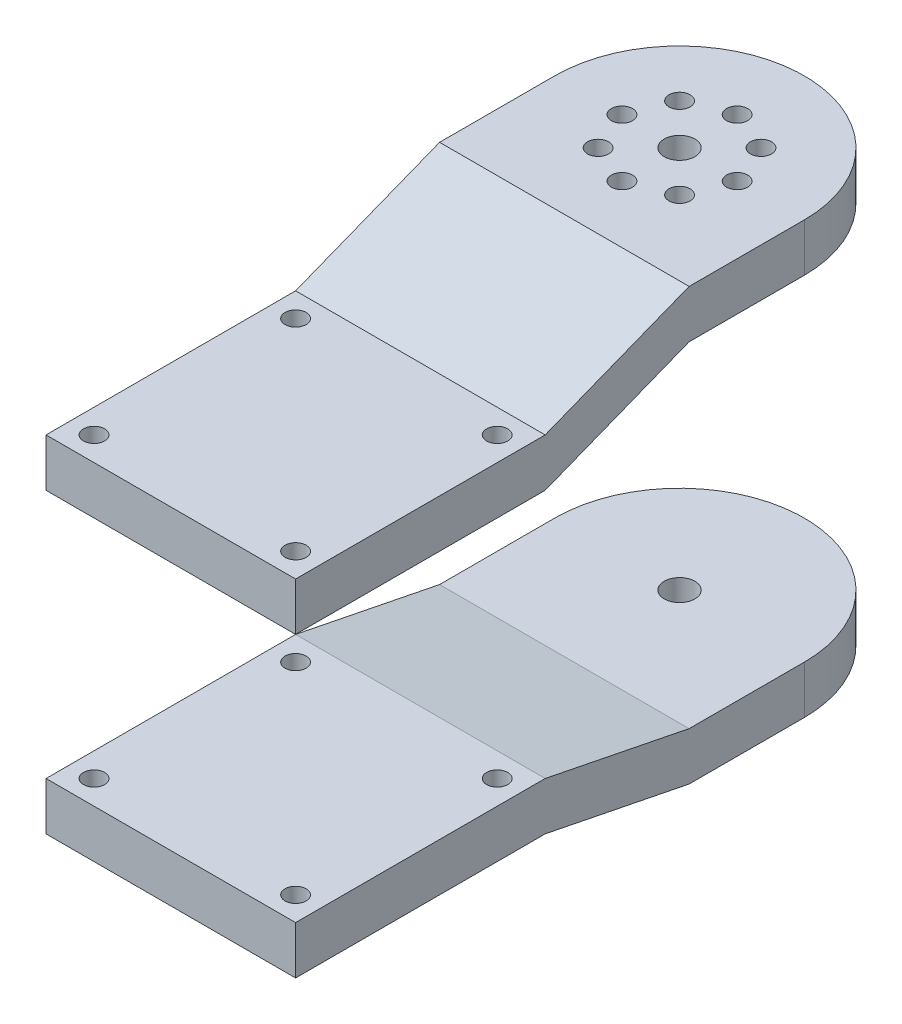
from build123d import *

# Parameters (mm, degrees)
SKETCH_1_R          = 1.1
SKETCH_1_R_2        = 1.6
EXTRUDE_1_DEPTH     = 5
SKETCH_2_R          = 1.6
SKETCH_2_R_2        = 1.1
EXTRUDE_2_DEPTH     = 5
EXTRUDE_START       = -5.9
SKETCH_4_W          = 26
SKETCH_4_H          = 26
SKETCH_4_R          = 1.1
EXTRUDE_3_DEPTH     = 5.9
SKETCH_5_W          = 26
SKETCH_5_H          = 26
SKETCH_5_R          = 1.1
EXTRUDE_4_DEPTH     = 3
EXTRUDE_5_DEPTH     = 26
CUT_EXTRUDE_1_DEPTH = 72.253140282


with BuildPart() as part:
    # ｽｹｯﾁ1 → ﾎﾞｽ - 押し出し1 (new body)
    with BuildSketch(Plane(origin=(0, 0, 0), x_dir=(1, 0, 0), z_dir=(0, 1, 0))):
        with BuildLine():
            Line((-13, 40), (-13, -13))
            Line((-13, -13), (13, -13))
            Line((13, -13), (13, 40))
            ThreePointArc((13, 40), (0, 53), (-13, 40))
        make_face()
        with Locations(Location((-10.5, 10.5, 0), (0, 0, 270))):
            Circle(SKETCH_1_R, mode=Mode.SUBTRACT)
        with Locations(Location((-10.5, -10.5, 0), (0, 0, 270))):
            Circle(SKETCH_1_R, mode=Mode.SUBTRACT)
        with Locations(Location((10.5, -10.5, 0), (0, 0, 270))):
            Circle(SKETCH_1_R, mode=Mode.SUBTRACT)
        with Locations(Location((10.5, 10.5, 0), (0, 0, 270))):
            Circle(SKETCH_1_R, mode=Mode.SUBTRACT)
        with Locations(Location((0, 46, 0), (0, 0, 270))):
            Circle(SKETCH_1_R, mode=Mode.SUBTRACT)
        with Locations(Location((4.242640687, 44.242640687, 0), (0, 0, 270))):
            Circle(SKETCH_1_R, mode=Mode.SUBTRACT)
        with Locations(Location((6, 40, 0), (0, 0, 270))):
            Circle(SKETCH_1_R, mode=Mode.SUBTRACT)
        with Locations(Location((4.242640687, 35.757359313, 0), (0, 0, 270))):
            Circle(SKETCH_1_R, mode=Mode.SUBTRACT)
        with Locations(Location((0, 34, 0), (0, 0, 270))):
            Circle(SKETCH_1_R, mode=Mode.SUBTRACT)
        with Locations(Location((-4.242640687, 35.757359313, 0), (0, 0, 270))):
            Circle(SKETCH_1_R, mode=Mode.SUBTRACT)
        with Locations(Location((-6, 40, 0), (0, 0, 270))):
            Circle(SKETCH_1_R, mode=Mode.SUBTRACT)
        with Locations(Location((-4.242640687, 44.242640687, 0), (0, 0, 270))):
            Circle(SKETCH_1_R, mode=Mode.SUBTRACT)
        with Locations(Location((0, 40, 0), (0, 0, 270))):
            Circle(SKETCH_1_R_2, mode=Mode.SUBTRACT)
    extrude(amount=EXTRUDE_1_DEPTH)

    # ｽｹｯﾁ4 → ﾎﾞｽ - 押し出し3 (add)
    with BuildSketch(Plane(origin=(0, 0, 0), x_dir=(1, 0, 0), z_dir=(0, 1, 0)).offset(EXTRUDE_START)):
        Rectangle(SKETCH_4_W, SKETCH_4_H)
        with Locations(Location((10.5, -10.5, 0), (0, 0, 270))):
            Circle(SKETCH_4_R, mode=Mode.SUBTRACT)
        with Locations(Location((-10.5, -10.5, 0), (0, 0, 270))):
            Circle(SKETCH_4_R, mode=Mode.SUBTRACT)
        with Locations(Location((-10.5, 10.5, 0), (0, 0, 270))):
            Circle(SKETCH_4_R, mode=Mode.SUBTRACT)
        with Locations(Location((10.5, 10.5, 0), (0, 0, 270))):
            Circle(SKETCH_4_R, mode=Mode.SUBTRACT)
    extrude(amount=EXTRUDE_3_DEPTH)



with BuildPart() as body_2:
    # ｽｹｯﾁ2 → ﾎﾞｽ - 押し出し2 (new body)
    with BuildSketch(Plane(origin=(0, -34.9, 0), x_dir=(1, 0, 0), z_dir=(0, 1, 0))):
        with BuildLine():
            Line((13, -13), (13, 40))
            ThreePointArc((13, 40), (0, 53), (-13, 40))
            Line((-13, 40), (-13, -13))
            Line((-13, -13), (13, -13))
        make_face()
        with Locations(Location((0, 40, 0), (0, 0, 270))):
            Circle(SKETCH_2_R, mode=Mode.SUBTRACT)
        with Locations(Location((10.5, -10.5, 0), (0, 0, 270))):
            Circle(SKETCH_2_R_2, mode=Mode.SUBTRACT)
        with Locations(Location((-10.5, -10.5, 0), (0, 0, 270))):
            Circle(SKETCH_2_R_2, mode=Mode.SUBTRACT)
        with Locations(Location((-10.5, 10.5, 0), (0, 0, 270))):
            Circle(SKETCH_2_R_2, mode=Mode.SUBTRACT)
        with Locations(Location((10.5, 10.5, 0), (0, 0, 270))):
            Circle(SKETCH_2_R_2, mode=Mode.SUBTRACT)
    extrude(amount=-EXTRUDE_2_DEPTH)

    # ｽｹｯﾁ5 → ﾎﾞｽ - 押し出し4 (add)
    with BuildSketch(Plane(origin=(0, -34.9, 0), x_dir=(1, 0, 0), z_dir=(0, 1, 0))):
        Rectangle(SKETCH_5_W, SKETCH_5_H)
        with Locations(Location((10.5, -10.5, 0), (0, 0, 270))):
            Circle(SKETCH_5_R, mode=Mode.SUBTRACT)
        with Locations(Location((-10.5, -10.5, 0), (0, 0, 270))):
            Circle(SKETCH_5_R, mode=Mode.SUBTRACT)
        with Locations(Location((-10.5, 10.5, 0), (0, 0, 270))):
            Circle(SKETCH_5_R, mode=Mode.SUBTRACT)
        with Locations(Location((10.5, 10.5, 0), (0, 0, 270))):
            Circle(SKETCH_5_R, mode=Mode.SUBTRACT)
    extrude(amount=EXTRUDE_4_DEPTH)


with BuildPart() as part_1:
    add(part.part)

    add(body_2.part)  # ﾎﾞｽ - 押し出し5 merges body 2
    # ｽｹｯﾁ6 → ﾎﾞｽ - 押し出し5 (add)
    with BuildSketch(Plane(origin=(13, 0, 0), x_dir=(0, 0, -1), z_dir=(1, 0, 0))):
        Polygon((28, 0), (13, -5.9), (13, 0), align=None)
        Polygon((13, -31.9), (13, -34.9), (28, -34.9), align=None)
    extrude(amount=-EXTRUDE_5_DEPTH)

    # ｽｹｯﾁ7 → ｶｯﾄ - 押し出し1 (cut, through all)
    with BuildSketch(Plane(origin=(13, 0, 0), x_dir=(0, 0, -1), z_dir=(1, 0, 0))):
        Polygon((28, 5), (13, -0.9), (-13, -0.9), (-13, 5), align=None)
        Polygon((28, -39.9), (-13, -39.9), (-13, -36.9), (13, -36.9), align=None)
    extrude(amount=-CUT_EXTRUDE_1_DEPTH, mode=Mode.SUBTRACT)


solid = part_1.part
